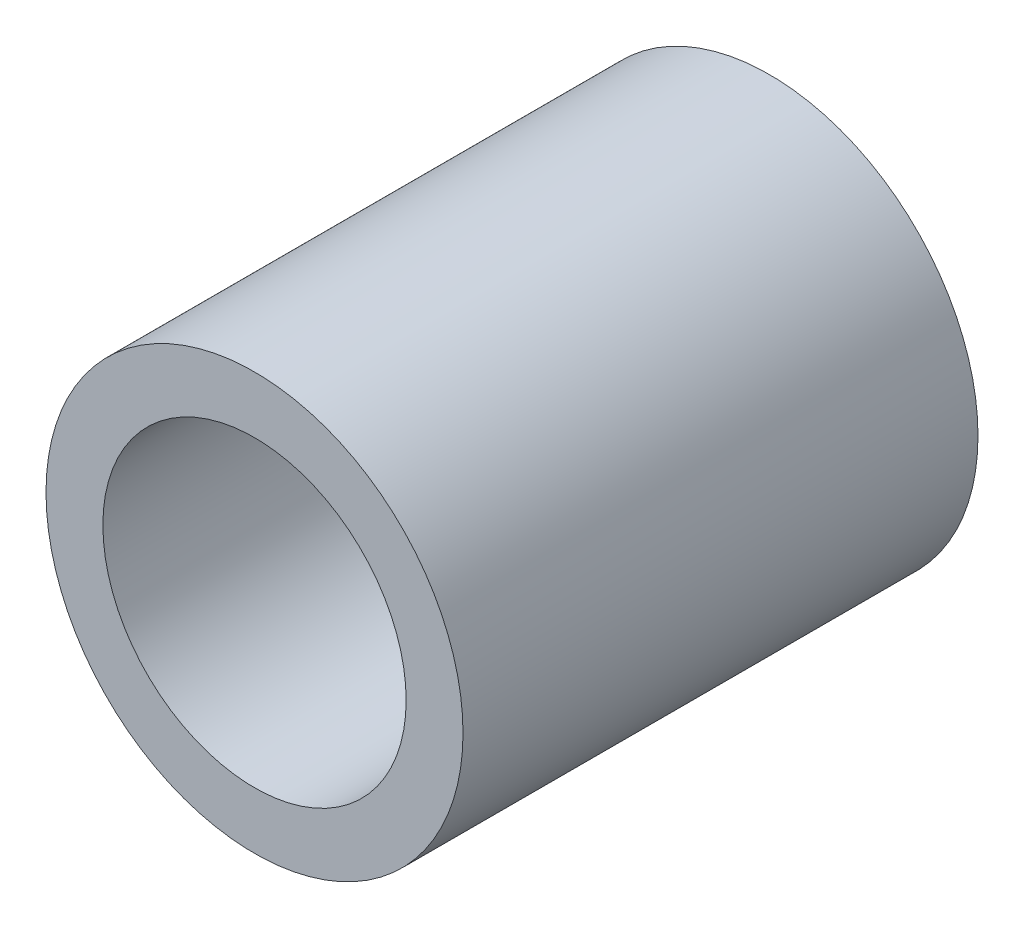
from build123d import *

# Parameters (mm, degrees)
SKETCH1_R           = 8.73125
SKETCH1_R_2         = 6.35
BOSS_EXTRUDE1_DEPTH = 21.5645492


with BuildPart() as part:
    # Sketch1 → Boss-Extrude1 (new body)
    with BuildSketch(Plane.XY):
        with Locations(Location((0, 0, 0), (0, 0, 180))):
            Circle(SKETCH1_R)
        with Locations(Location((0, 0, 0), (0, 0, 180))):
            Circle(SKETCH1_R_2, mode=Mode.SUBTRACT)
    extrude(amount=BOSS_EXTRUDE1_DEPTH)


solid = part.part
